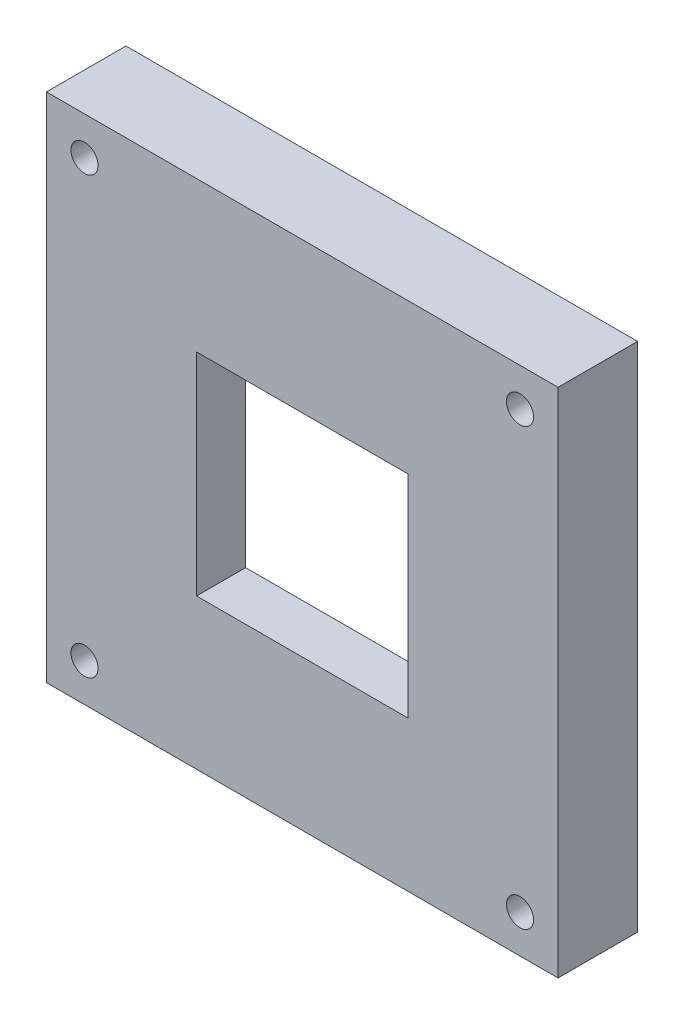
from build123d import *

# Parameters (mm, degrees)
EXTRUDE_1_DEPTH          = 7
EXTRUDE_1_DEPTH_BACK     = 2.4
SKETCH_1_W               = 60.5
SKETCH_1_H               = 60.5
SKETCH_1_W_2             = 38.5
SKETCH_1_H_2             = 38.5
SKETCH_2_W               = 38.5
SKETCH_2_H               = 38.5
SKETCH_2_W_2             = 25
SKETCH_2_H_2             = 25
EXTRUDE_3_DEPTH          = 5.8
CUT_EXTRUDE_1_DEPTH      = 2.4
CUT_EXTRUDE_2_DEPTH      = 44.800513696
CUT_EXTRUDE_2_DEPTH_BACK = 44.800513696
SKETCH_5_R               = 1.6


with BuildPart() as part:
    # ｽｹｯﾁ1 → ﾎﾞｽ - 押し出し1 (new, two sides: drawn at the far end of the back side and taken through both)
    with BuildSketch(Plane.XY.offset(-EXTRUDE_1_DEPTH_BACK)):
        Rectangle(SKETCH_1_W, SKETCH_1_H)
        Rectangle(SKETCH_1_W_2, SKETCH_1_H_2, mode=Mode.SUBTRACT)
    extrude(amount=EXTRUDE_1_DEPTH + EXTRUDE_1_DEPTH_BACK)

    # ｽｹｯﾁ2 → ﾎﾞｽ - 押し出し3 (add)
    with BuildSketch(Plane.XY.offset(1.2)):
        Rectangle(SKETCH_2_W, SKETCH_2_H)
        Rectangle(SKETCH_2_W_2, SKETCH_2_H_2, mode=Mode.SUBTRACT)
    extrude(amount=EXTRUDE_3_DEPTH)

    # ｽｹｯﾁ3 → ｶｯﾄ - 押し出し1 (cut)
    with BuildSketch(Plane(origin=(0, 0, -2.4), x_dir=(-1, 0, 0), z_dir=(0, 0, -1))):
        with BuildLine():
            ThreePointArc((-24.95, 19.25), (-23.280508653, 23.280508653), (-19.25, 24.95))
            Line((-19.25, 24.95), (19.25, 24.95))
            ThreePointArc((19.25, 24.95), (23.280508653, 23.280508653), (24.95, 19.25))
            Line((24.95, 19.25), (24.95, -19.25))
            ThreePointArc((24.95, -19.25), (23.280508653, -23.280508653), (19.25, -24.95))
            Line((19.25, -24.95), (-19.25, -24.95))
            ThreePointArc((-19.25, -24.95), (-23.280508653, -23.280508653), (-24.95, -19.25))
            Line((-24.95, -19.25), (-24.95, 19.25))
        make_face()
        with BuildLine():
            Line((-20.75, -19.25), (-20.75, 19.25))
            ThreePointArc((-20.75, 19.25), (-20.310660172, 20.310660172), (-19.25, 20.75))
            Line((-19.25, 20.75), (19.25, 20.75))
            ThreePointArc((19.25, 20.75), (20.310660172, 20.310660172), (20.75, 19.25))
            Line((20.75, 19.25), (20.75, -19.25))
            ThreePointArc((20.75, -19.25), (20.310660172, -20.310660172), (19.25, -20.75))
            Line((19.25, -20.75), (-19.25, -20.75))
            ThreePointArc((-19.25, -20.75), (-20.310660172, -20.310660172), (-20.75, -19.25))
        make_face(mode=Mode.SUBTRACT)
    extrude(amount=-CUT_EXTRUDE_1_DEPTH, mode=Mode.SUBTRACT)

    # ｽｹｯﾁ5 → ｶｯﾄ - 押し出し2 (cut, two sides: drawn at the far end of the back side and taken through both)
    with BuildSketch(Plane(origin=(0, 0, -2.4), x_dir=(-1, 0, 0), z_dir=(0, 0, -1)).offset(-CUT_EXTRUDE_2_DEPTH_BACK)):
        with Locations((-25.75, 25.75)):
            Circle(SKETCH_5_R)
        with Locations((25.75, 25.75)):
            Circle(SKETCH_5_R)
        with Locations((25.75, -25.75)):
            Circle(SKETCH_5_R)
        with Locations((-25.75, -25.75)):
            Circle(SKETCH_5_R)
    extrude(amount=CUT_EXTRUDE_2_DEPTH + CUT_EXTRUDE_2_DEPTH_BACK, mode=Mode.SUBTRACT)


solid = part.part
